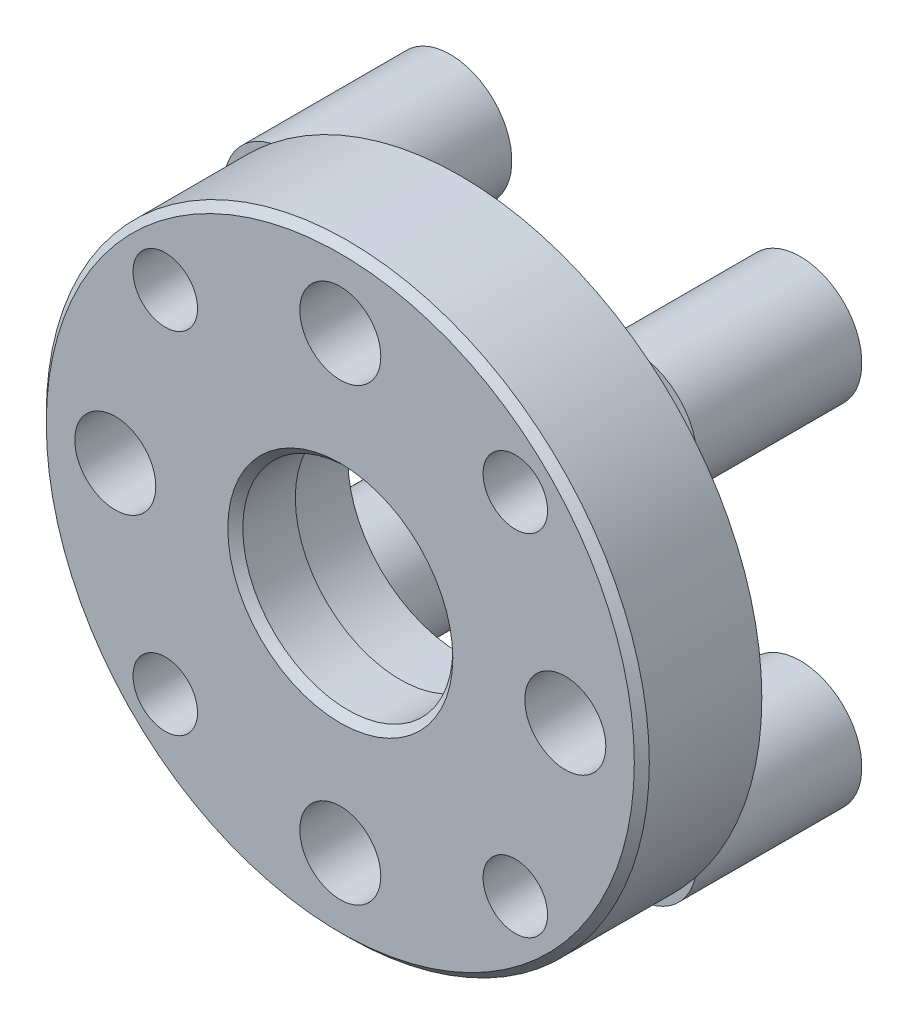
from build123d import *

# Parameters (mm, degrees)
SKETCH3_R             = 4
BOSS_EXTRUDE1_DEPTH   = 11
BOSS_EXTRUDE1_2_DEPTH = 11
BOSS_EXTRUDE1_3_DEPTH = 11
BOSS_EXTRUDE1_4_DEPTH = 11
SKETCH6_R             = 7.5
BOSS_EXTRUDE6_DEPTH   = 8
SKETCH8_R             = 1.6
CUT_EXTRUDE1_DEPTH    = 35.190934471
SKETCH9_R             = 3
CUT_EXTRUDE2_DEPTH    = 3
BOSS_EXTRUDE8_START   = -11
SKETCH10_R            = 4.1
SKETCH10_R_2          = 4
BOSS_EXTRUDE8_DEPTH   = 11
SKETCH11_R            = 2.7
SKETCH11_R_2          = 2.15
CUT_EXTRUDE3_DEPTH    = 8
BOSS_EXTRUDE9_START   = -4
SKETCH12_R            = 7.5
SKETCH12_R_2          = 7
BOSS_EXTRUDE9_DEPTH   = 4
CHAMFER1_SIZE         = 0.5


with BuildPart() as part:
    # Sketch3 → Boss-Extrude1 (new body)
    with BuildSketch(Plane(origin=(0, 0, -116.757942017), x_dir=(-1, 0, 0), z_dir=(0, 0, -1))):
        with Locations((-11.66726189, 11.66726189)):
            Circle(SKETCH3_R)
    extrude(amount=BOSS_EXTRUDE1_DEPTH)



with BuildPart() as body_2:
    # Sketch3 → Boss-Extrude1 2 (new body)
    with BuildSketch(Plane(origin=(0, 0, -116.757942017), x_dir=(-1, 0, 0), z_dir=(0, 0, -1))):
        with Locations((11.66726189, 11.66726189)):
            Circle(SKETCH3_R)
    extrude(amount=BOSS_EXTRUDE1_2_DEPTH)


with BuildPart() as body_3:
    # Sketch3 → Boss-Extrude1 3 (new body)
    with BuildSketch(Plane(origin=(0, 0, -116.757942017), x_dir=(-1, 0, 0), z_dir=(0, 0, -1))):
        with Locations((11.66726189, -11.66726189)):
            Circle(SKETCH3_R)
    extrude(amount=BOSS_EXTRUDE1_3_DEPTH)


with BuildPart() as body_4:
    # Sketch3 → Boss-Extrude1 4 (new body)
    with BuildSketch(Plane(origin=(0, 0, -116.757942017), x_dir=(-1, 0, 0), z_dir=(0, 0, -1))):
        with Locations((-11.66726189, -11.66726189)):
            Circle(SKETCH3_R)
    extrude(amount=BOSS_EXTRUDE1_4_DEPTH)


with BuildPart() as part_1:
    add(part.part)

    add(body_2.part)  # Boss-Extrude6 merges body 2

    add(body_3.part)  # Boss-Extrude6 merges body 3

    add(body_4.part)  # Boss-Extrude6 merges body 4
    # Sketch6 → Boss-Extrude6 (add)
    with BuildSketch(Plane.XY.offset(-116.757942017)):
        with BuildLine():
            ThreePointArc((16.992766074, -10.735730117), (19.607007689, 4.424392555), (10.735730117, 16.992766074))
            ThreePointArc((10.735730117, 16.992766074), (-4.424392555, 19.607007689), (-16.992766074, 10.735730117))
            ThreePointArc((-16.992766074, 10.735730117), (-19.607007689, -4.424392555), (-10.735730117, -16.992766074))
            ThreePointArc((-10.735730117, -16.992766074), (4.424392555, -19.607007689), (16.992766074, -10.735730117))
        make_face()
        Circle(SKETCH6_R, mode=Mode.SUBTRACT)
    extrude(amount=BOSS_EXTRUDE6_DEPTH)

    # Sketch8 → Cut-Extrude1 (cut, through all)
    with BuildSketch(Plane.XY.offset(-108.757942017)):
        with Locations((11.66726189, 11.66726189)):
            Circle(SKETCH8_R)
        with Locations((11.66726189, -11.66726189)):
            Circle(SKETCH8_R)
        with Locations((-11.66726189, -11.66726189)):
            Circle(SKETCH8_R)
        with Locations((-11.66726189, 11.66726189)):
            Circle(SKETCH8_R)
    extrude(amount=-CUT_EXTRUDE1_DEPTH, mode=Mode.SUBTRACT)

    # Sketch9 → Cut-Extrude2 (cut)
    with BuildSketch(Plane.XY.offset(-127.757942017)):
        with Locations(Location((11.66726189, 11.66726189, 0), (0, 0, 180))):
            Circle(SKETCH9_R)
        with Locations(Location((11.66726189, -11.66726189, 0), (0, 0, 180))):
            Circle(SKETCH9_R)
        with Locations(Location((-11.66726189, -11.66726189, 0), (0, 0, 180))):
            Circle(SKETCH9_R)
        with Locations(Location((-11.66726189, 11.66726189, 0), (0, 0, 180))):
            Circle(SKETCH9_R)
    extrude(amount=CUT_EXTRUDE2_DEPTH, mode=Mode.SUBTRACT)

    # Sketch10 → Boss-Extrude8 (add)
    # profile 1 of 4: a face of its own
    with BuildSketch(Plane(origin=(0, 0, -127.757942017), x_dir=(-1, 0, 0), z_dir=(0, 0, -1)).offset(BOSS_EXTRUDE8_START)):
        with Locations((11.66726189, 11.66726189)):
            Circle(SKETCH10_R)
        with Locations((11.66726189, 11.66726189)):
            Circle(SKETCH10_R_2, mode=Mode.SUBTRACT)
    # profile 2 of 4: a face of its own
    with BuildSketch(Plane(origin=(0, 0, -127.757942017), x_dir=(-1, 0, 0), z_dir=(0, 0, -1)).offset(BOSS_EXTRUDE8_START)):
        with Locations((11.66726189, -11.66726189)):
            Circle(SKETCH10_R)
        with Locations((11.66726189, -11.66726189)):
            Circle(SKETCH10_R_2, mode=Mode.SUBTRACT)
    # profile 3 of 4: a face of its own
    with BuildSketch(Plane(origin=(0, 0, -127.757942017), x_dir=(-1, 0, 0), z_dir=(0, 0, -1)).offset(BOSS_EXTRUDE8_START)):
        with Locations((-11.66726189, -11.66726189)):
            Circle(SKETCH10_R)
        with Locations((-11.66726189, -11.66726189)):
            Circle(SKETCH10_R_2, mode=Mode.SUBTRACT)
    # profile 4 of 4: a face of its own
    with BuildSketch(Plane(origin=(0, 0, -127.757942017), x_dir=(-1, 0, 0), z_dir=(0, 0, -1)).offset(BOSS_EXTRUDE8_START)):
        with Locations((-11.66726189, 11.66726189)):
            Circle(SKETCH10_R)
        with Locations((-11.66726189, 11.66726189)):
            Circle(SKETCH10_R_2, mode=Mode.SUBTRACT)
    extrude(amount=BOSS_EXTRUDE8_DEPTH)

    # Sketch11 → Cut-Extrude3 (cut)
    with BuildSketch(Plane.XY.offset(-108.757942017)):
        with Locations((0, 15)):
            Circle(SKETCH11_R)
        with Locations((15, 0)):
            Circle(SKETCH11_R)
        with Locations((0, -15)):
            Circle(SKETCH11_R)
        with Locations((-15, 0)):
            Circle(SKETCH11_R)
        with Locations((-11.66726189, 11.66726189)):
            Circle(SKETCH11_R_2)
        with Locations((11.66726189, 11.66726189)):
            Circle(SKETCH11_R_2)
        with Locations((11.66726189, -11.66726189)):
            Circle(SKETCH11_R_2)
        with Locations((-11.66726189, -11.66726189)):
            Circle(SKETCH11_R_2)
    extrude(amount=-CUT_EXTRUDE3_DEPTH, mode=Mode.SUBTRACT)

    # Sketch12 → Boss-Extrude9 (add)
    with BuildSketch(Plane.XY.offset(-108.757942017).offset(BOSS_EXTRUDE9_START)):
        Circle(SKETCH12_R)
        Circle(SKETCH12_R_2, mode=Mode.SUBTRACT)
    extrude(amount=BOSS_EXTRUDE9_DEPTH)

    # Chamfer1
    chamfer1_edges = [part_1.edges().sort_by_distance(p)[0] for p in [
        (-10.735730117, -16.992766074, -108.757942017),
        (-7, 0, -108.757942017),
    ]]
    chamfer(chamfer1_edges, length=CHAMFER1_SIZE)


solid = part_1.part
